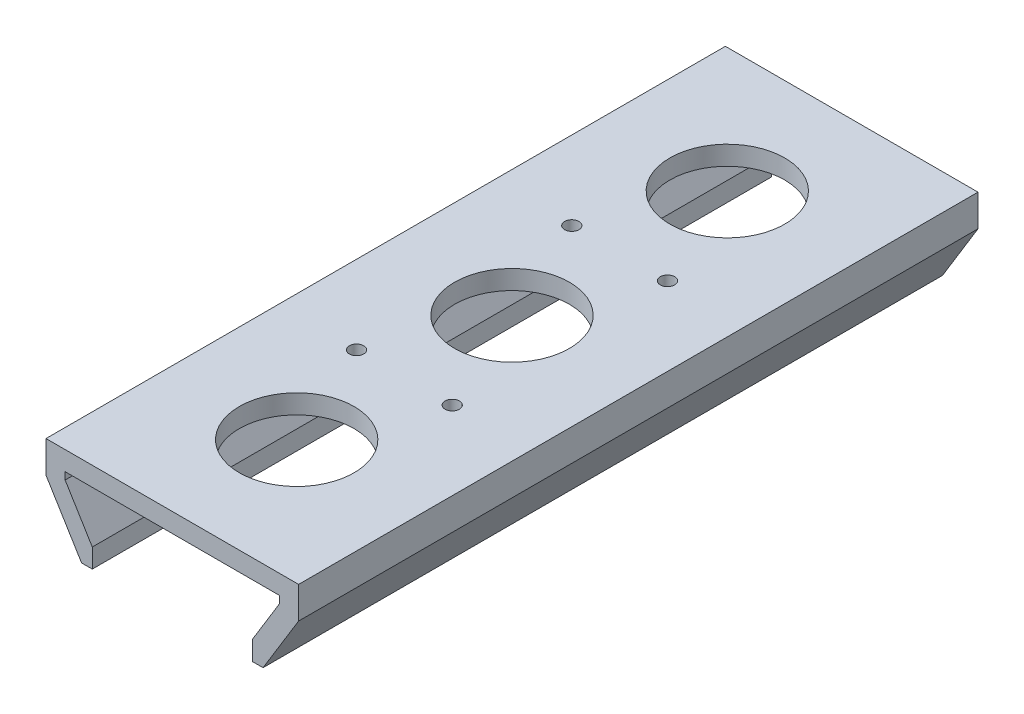
from build123d import *

# Parameters (mm, degrees)
BOSS_EXTRUDE1_DEPTH = 142
SKETCH2_R           = 12
CUT_EXTRUDE1_DEPTH  = 213
SKETCH3_R           = 1.5
CUT_EXTRUDE2_DEPTH  = 10


with BuildPart() as part:
    # Sketch1 → Boss-Extrude1 (new body)
    with BuildSketch(Plane.XY):
        Polygon((0, -13.089354466), (-22.4, -13.089354466), (-22.4, -14.60190076), (-16.724333847, -23.889354466), (-16.724333847, -27.889354466), (-18.967672316, -27.889354466), (-26.4, -15.727363709), (-26.4, -9.089354466), (26.4, -9.089354466), (26.4, -15.727363709), (18.967672316, -27.889354466), (16.724333847, -27.889354466), (16.724333847, -23.889354466), (22.4, -14.60190076), (22.4, -13.089354466), align=None)
    extrude(amount=BOSS_EXTRUDE1_DEPTH)

    # Sketch2 → Cut-Extrude1 (cut)
    with BuildSketch(Plane(origin=(0, -9.089354466, 0), x_dir=(1, 0, 0), z_dir=(0, 1, 0))):
        with Locations(Location((0, -26, 0), (0, 0, 180))):
            Circle(SKETCH2_R)
        with Locations(Location((0, -71, 0), (0, 0, 180))):
            Circle(SKETCH2_R)
        with Locations(Location((0, -116, 0), (0, 0, 180))):
            Circle(SKETCH2_R)
    extrude(amount=-CUT_EXTRUDE1_DEPTH, mode=Mode.SUBTRACT)

    # Sketch3 → Cut-Extrude2 (cut)
    with BuildSketch(Plane(origin=(0, -9.089354466, 0), x_dir=(1, 0, 0), z_dir=(0, 1, 0))):
        with Locations(Location((-10, -93.5, 0), (0, 0, 180))):
            Circle(SKETCH3_R)
        with Locations((10, -93.5)):
            Circle(SKETCH3_R)
        with Locations(Location((10, -48.5, 0), (0, 0, 180))):
            Circle(SKETCH3_R)
        with Locations((-10, -48.5)):
            Circle(SKETCH3_R)
    extrude(amount=-CUT_EXTRUDE2_DEPTH, mode=Mode.SUBTRACT)


solid = part.part
